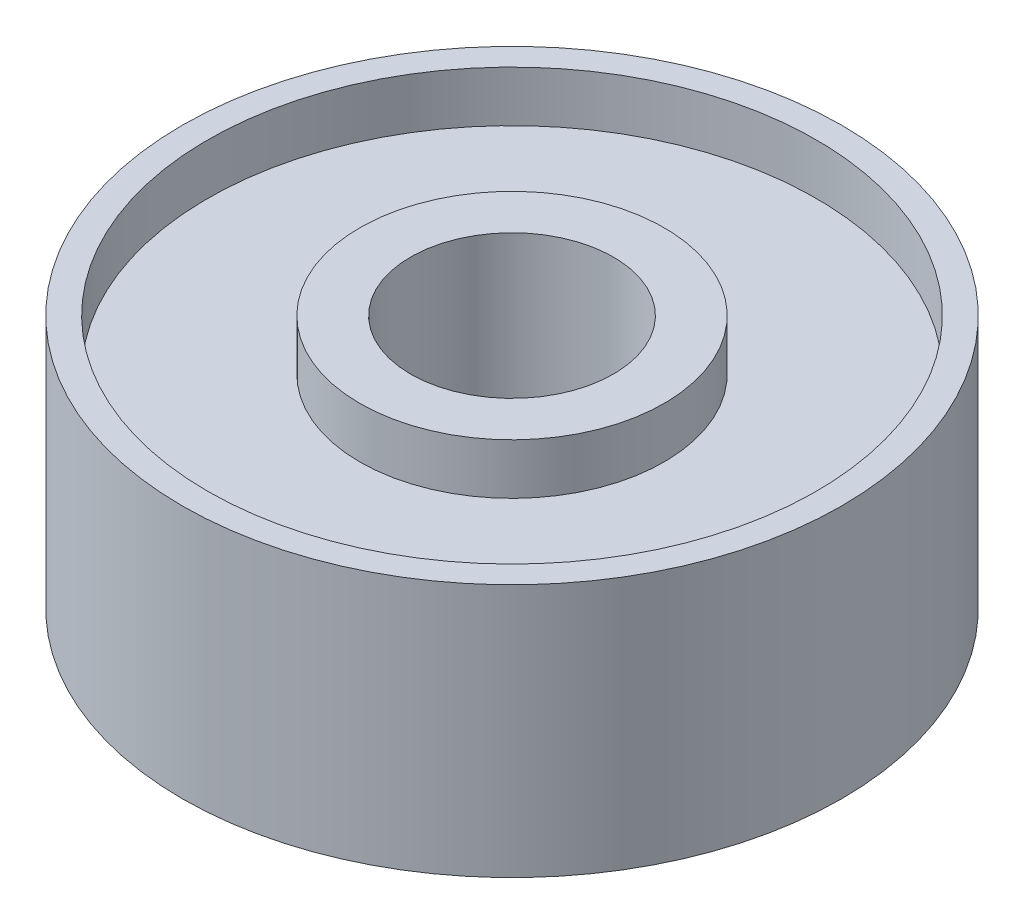
from build123d import *

# Parameters (mm, degrees)
SKETCH_1_R          = 6.5
SKETCH_1_R_2        = 2
EXTRUDE_1_DEPTH     = 5
SKETCH_2_R          = 6
SKETCH_2_R_2        = 3
CUT_EXTRUDE_1_DEPTH = 1
CUT_EXTRUDE_START   = -1
SKETCH_3_R          = 6
SKETCH_3_R_2        = 3
CUT_EXTRUDE_2_DEPTH = 1


with BuildPart() as part:
    # Эскиз1 → Бобышка-Вытянуть1 (new body)
    with BuildSketch(Plane(origin=(0, 0, 0), x_dir=(1, 0, 0), z_dir=(0, 1, 0))):
        with Locations(Location((0, 0, 0), (0, 0, 270))):
            Circle(SKETCH_1_R)
        with Locations(Location((0, 0, 0), (0, 0, 270))):
            Circle(SKETCH_1_R_2, mode=Mode.SUBTRACT)
    extrude(amount=EXTRUDE_1_DEPTH)

    # Эскиз2 → Вырез-Вытянуть1 (cut)
    with BuildSketch(Plane(origin=(0, 5, 0), x_dir=(1, 0, 0), z_dir=(0, 1, 0))):
        with Locations(Location((0, 0, 0), (0, 0, 270))):
            Circle(SKETCH_2_R)
        with Locations(Location((0, 0, 0), (0, 0, 270))):
            Circle(SKETCH_2_R_2, mode=Mode.SUBTRACT)
    extrude(amount=-CUT_EXTRUDE_1_DEPTH, mode=Mode.SUBTRACT)

    # Эскиз3 → Вырез-Вытянуть2 (cut)
    with BuildSketch(Plane.XZ.offset(CUT_EXTRUDE_START)):
        with Locations(Location((0, 0, 0), (0, 0, 90))):
            Circle(SKETCH_3_R)
        with Locations(Location((0, 0, 0), (0, 0, 90))):
            Circle(SKETCH_3_R_2, mode=Mode.SUBTRACT)
    extrude(amount=CUT_EXTRUDE_2_DEPTH, mode=Mode.SUBTRACT)


solid = part.part
